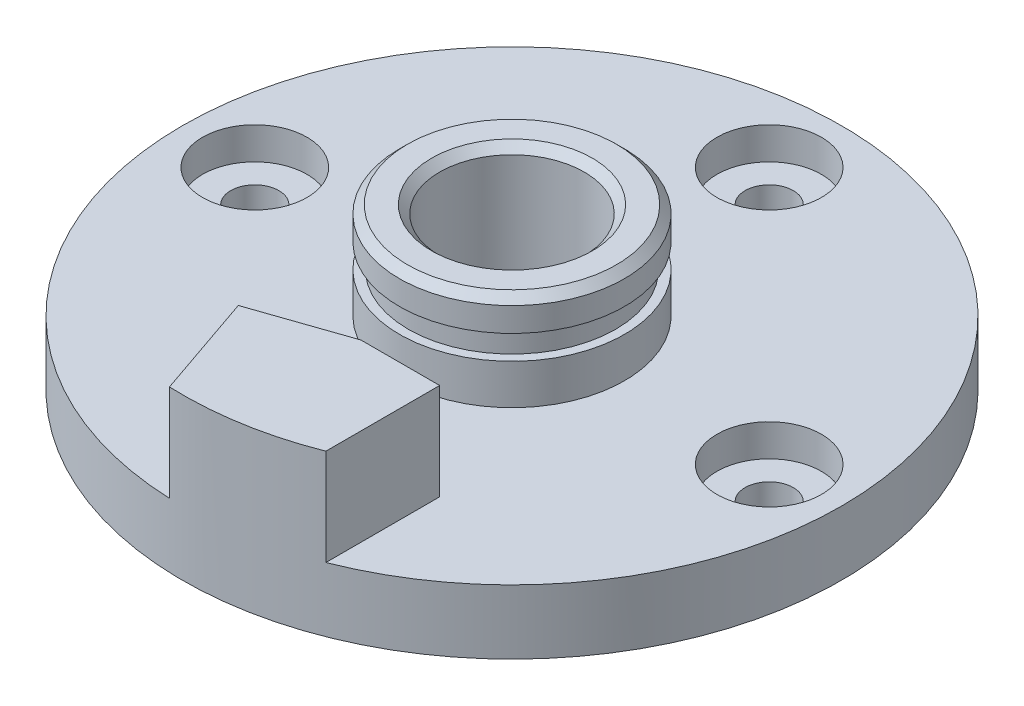
from build123d import *

# Parameters (mm, degrees)
SKETCH_2_R          = 1.5
CUT_EXTRUDE_1_DEPTH = 31.66757245
CUT_EXTRUDE_START   = 4
SKETCH_3_R          = 3.25
CUT_EXTRUDE_2_DEPTH = 2
EXTRUDE_START       = 6
EXTRUDE_1_DEPTH     = 6
SKETCH_5_R          = 7.5
CUT_EXTRUDE_3_DEPTH = 1
CHAMFER_1_SIZE      = 0.5
CHAMFER_2_SIZE      = 0.5
CUT_EXTRUDE_6_DEPTH = 6
EXTRUDE_2_DEPTH     = 6


with BuildPart() as part:
    # 草图1 → 旋转1 (revolve)
    with BuildSketch(Plane.XY):
        Polygon((-4.5, 0), (-20.5, 0), (-20.5, 4), (-7, 4), (-7, 6.5), (-6.45, 6.5), (-6.45, 8), (-7, 8), (-7, 10), (-4.5, 10), align=None)
    revolve(axis=Axis((0, 7, 0), (0, -1, 0)))

    # 草图2 → 切除-拉伸1 (cut, through all)
    with BuildSketch(Plane(origin=(0, 0, 0), x_dir=(1, 0, 0), z_dir=(0, 1, 0))):
        with Locations(Location((-16, 0, 0), (0, 0, 180))):
            Circle(SKETCH_2_R)
        with Locations(Location((0, 16, 0), (0, 0, 180))):
            Circle(SKETCH_2_R)
        with Locations(Location((16, 0, 0), (0, 0, 180))):
            Circle(SKETCH_2_R)
    extrude(amount=CUT_EXTRUDE_1_DEPTH, mode=Mode.SUBTRACT)

    # 草图3 → 切除-拉伸2 (cut)
    with BuildSketch(Plane(origin=(0, 0, 0), x_dir=(1, 0, 0), z_dir=(0, 1, 0)).offset(CUT_EXTRUDE_START)):
        with Locations(Location((-16, 0, 0), (0, 0, 180))):
            Circle(SKETCH_3_R)
        with Locations(Location((0, 16, 0), (0, 0, 180))):
            Circle(SKETCH_3_R)
        with Locations(Location((16, 0, 0), (0, 0, 180))):
            Circle(SKETCH_3_R)
    extrude(amount=-CUT_EXTRUDE_2_DEPTH, mode=Mode.SUBTRACT)

    # 草图4 → 凸台-拉伸1 (add)
    with BuildSketch(Plane(origin=(0, 4, 0), x_dir=(1, 0, 0), z_dir=(0, 1, 0)).offset(EXTRUDE_START)):
        with BuildLine():
            Line((7.5, -12), (-7.5, -12))
            Line((-7.5, -12), (-7.5, -19.078784028))
            ThreePointArc((-7.5, -19.078784028), (0, -20.5), (7.5, -19.078784028))
            Line((7.5, -19.078784028), (7.5, -12))
        make_face()
    extrude(amount=-EXTRUDE_1_DEPTH)

    # 草图5 → 切除-拉伸3 (cut)
    with BuildSketch(Plane.XZ):
        Circle(SKETCH_5_R)
    extrude(amount=-CUT_EXTRUDE_3_DEPTH, mode=Mode.SUBTRACT)

    # 倒角1
    chamfer_1_edges = [part.edges().sort_by_distance(p)[0] for p in [
        (4.5, 1, 0),
        (4.5, 10, 0),
    ]]
    chamfer(chamfer_1_edges, length=CHAMFER_1_SIZE)

    # 倒角2
    chamfer_2_edges = [part.edges().sort_by_distance(p)[0] for p in [
        (7, 10, 0),
    ]]
    chamfer(chamfer_2_edges, length=CHAMFER_2_SIZE)

    # 草图6 → 切除-拉伸6 (cut)
    with BuildSketch(Plane(origin=(0, 10, 0), x_dir=(1, 0, 0), z_dir=(0, 1, 0))):
        Polygon((2.6, -12), (-1.967727288, -14.033683215), (1.296257598, -21.364713299), (-7.5, -20.062419665), (-7.5, -12), align=None)
    extrude(amount=-CUT_EXTRUDE_6_DEPTH, mode=Mode.SUBTRACT)

    # 草图7 → 凸台-拉伸2 (add)
    with BuildSketch(Plane(origin=(0, 4, 0), x_dir=(1, 0, 0), z_dir=(0, 1, 0)).offset(EXTRUDE_START)):
        with BuildLine():
            Line((2.6, -12), (-3.073111454, -13.953408927))
            Line((-3.073111454, -13.953408927), (-0.824652926, -20.483406639))
            ThreePointArc((-0.824652926, -20.483406639), (0.038915526, -20.499963063), (0.902414897, -20.480128109))
            Line((0.902414897, -20.480128109), (-1.967727288, -14.033683215))
            Line((-1.967727288, -14.033683215), (2.6, -12))
        make_face()
    extrude(amount=-EXTRUDE_2_DEPTH)


solid = part.part
